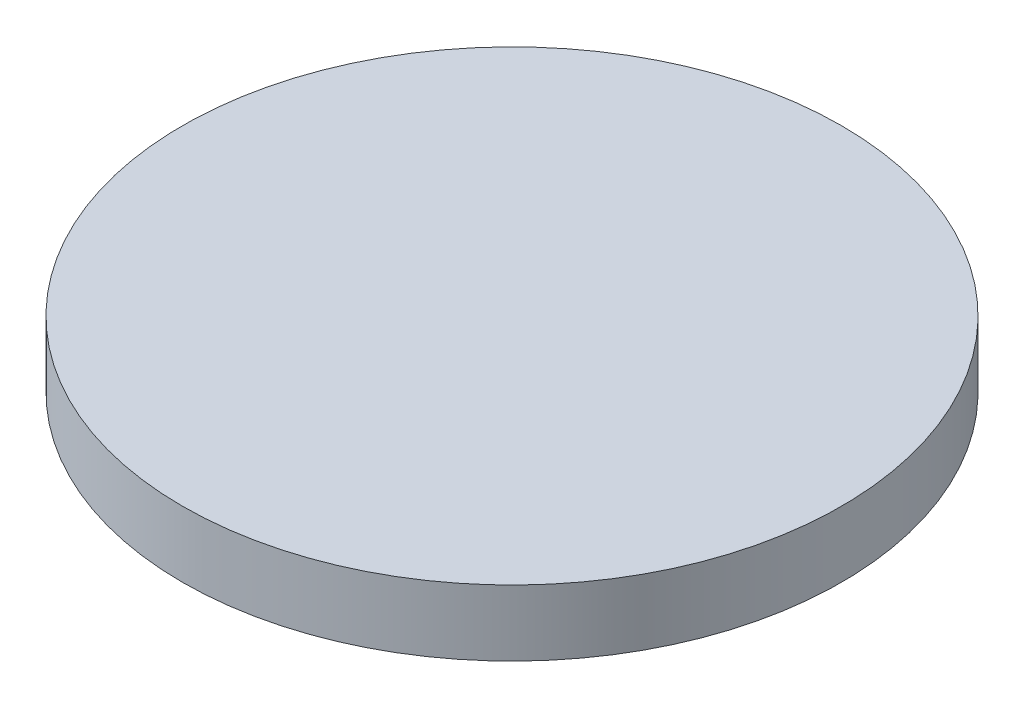
from build123d import *

# Parameters (mm, degrees)
BASES_R    = 2.5
BASE_DEPTH = 0.5


with BuildPart() as part:
    # BaseS → BASE (new body)
    with BuildSketch(Plane(origin=(0, 0, 0), x_dir=(1, 0, 0), z_dir=(0, 1, 0))):
        with Locations(Location((0, 0, 0), (0, 0, 270))):
            Circle(BASES_R)
    extrude(amount=-BASE_DEPTH)


solid = part.part
